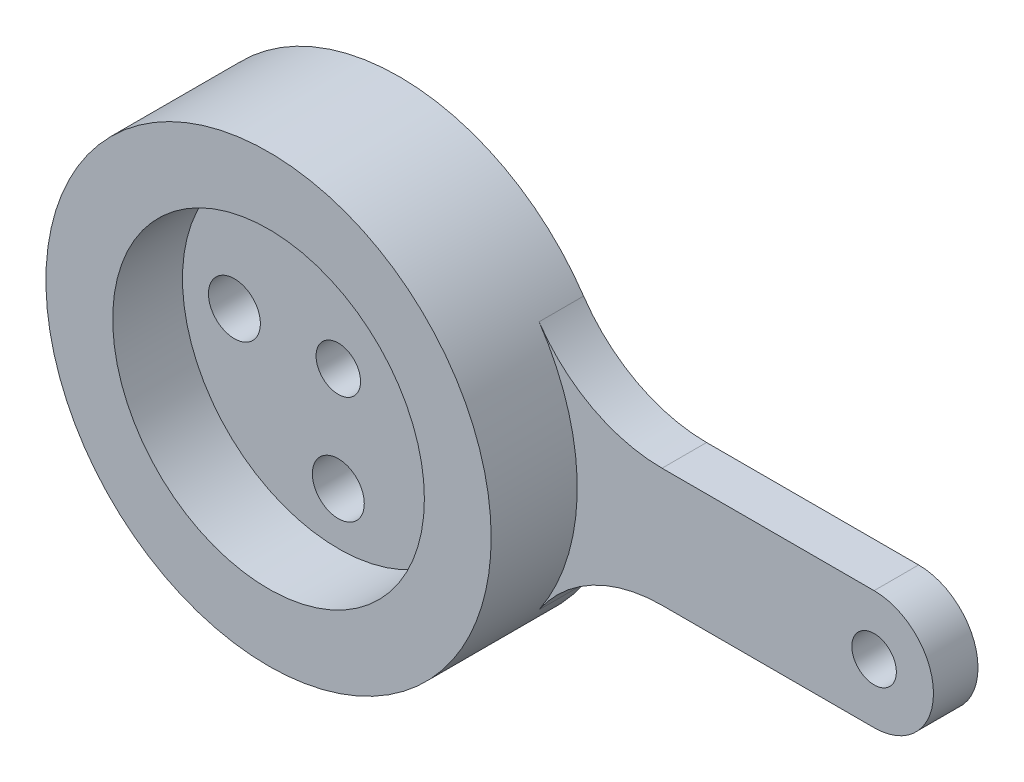
from build123d import *
from build123d.topology import SkipClean

# Parameters (mm, degrees)
SKETCH1_R           = 15
BOSS_EXTRUDE1_DEPTH = 8.8
CUT_EXTRUDE1_DEPTH  = 5
SKETCH3_R           = 1.5
CUT_EXTRUDE2_DEPTH  = 5
BOSS_EXTRUDE2_DEPTH = 3
FILLET1_R           = 10
FILLET2_R           = 10
SKETCH6_R           = 1.5
CUT_EXTRUDE4_DEPTH  = 3
SKETCH7_R           = 10.5
CUT_EXTRUDE6_DEPTH  = 5
BOSS_EXTRUDE3_DEPTH = 0.3
BOSS_EXTRUDE4_START = -4.7
BOSS_EXTRUDE4_DEPTH = 4.7
SKETCH11_R          = 1.5
CUT_EXTRUDE7_DEPTH  = 43.083250825
SKETCH12_R          = 1.75
CUT_EXTRUDE8_DEPTH  = 43.701756404


with BuildPart() as part:
    # Sketch1 → Boss-Extrude1 (new body)
    with BuildSketch(Plane.XY):
        Circle(SKETCH1_R)
    extrude(amount=BOSS_EXTRUDE1_DEPTH)

    # Sketch2 → Cut-Extrude1 (cut)
    with BuildSketch(Plane.XY.offset(8.8)):
        with BuildLine():
            Line((-2.469689731, 16.888114198), (-4.5, 3.968626967))
            ThreePointArc((-4.5, 3.968626967), (-6, 0), (-4.5, -3.968626967))
            Line((-4.5, -3.968626967), (-2.469689731, -16.888114198))
            ThreePointArc((-2.469689731, -16.888114198), (0, -19), (2.469689731, -16.888114198))
            Line((2.469689731, -16.888114198), (4.5, -3.968626967))
            ThreePointArc((4.5, -3.968626967), (6, 0), (4.5, 3.968626967))
            Line((4.5, 3.968626967), (2.469689731, 16.888114198))
            ThreePointArc((2.469689731, 16.888114198), (0, 19), (-2.469689731, 16.888114198))
        make_face()
    extrude(amount=-CUT_EXTRUDE1_DEPTH, mode=Mode.SUBTRACT)

    # Sketch3 → Cut-Extrude2 (cut)
    with BuildSketch(Plane.XY.offset(3.8)):
        Circle(SKETCH3_R)
    extrude(amount=-CUT_EXTRUDE2_DEPTH, mode=Mode.SUBTRACT)

    # Sketch4 → Boss-Extrude2 (add)
    with BuildSketch(Plane(origin=(0, 0, 0), x_dir=(-1, 0, 0), z_dir=(0, 0, -1))):
        with BuildLine():
            Line((-35, 4), (-14.456832295, 4))
            ThreePointArc((-14.456832295, 4), (-15, 0), (-14.456832295, -4))
            Line((-14.456832295, -4), (-35, -4))
            ThreePointArc((-35, -4), (-39, 0), (-35, 4))
        make_face()
    extrude(amount=-BOSS_EXTRUDE2_DEPTH)

    # Fillet1
    fillet1_edges = [part.edges().sort_by_distance(p)[0] for p in [
        (14.456832295, 4, 1.5),
    ]]
    fillet(fillet1_edges, radius=FILLET1_R)

    # Fillet2
    fillet2_edges = [part.edges().sort_by_distance(p)[0] for p in [
        (14.456832295, -4, 1.5),
    ]]
    fillet(fillet2_edges, radius=FILLET2_R)

    # Sketch6 → Cut-Extrude4 (cut)
    with BuildSketch(Plane.XY.offset(3)):
        with Locations((35, 0)):
            Circle(SKETCH6_R)
    extrude(amount=-CUT_EXTRUDE4_DEPTH, mode=Mode.SUBTRACT)

    # Sketch7 → Cut-Extrude6 (cut)
    with BuildSketch(Plane.XY.offset(3.8)):
        Circle(SKETCH7_R)
    extrude(amount=CUT_EXTRUDE6_DEPTH, mode=Mode.SUBTRACT)

    # Sketch8 → Boss-Extrude3 (add)
    with BuildSketch(Plane.XY.offset(3.8)):
        with BuildLine():
            Line((-2.808083405, 14.73481142), (-3.572005324, 9.873741842))
            ThreePointArc((-3.572005324, 9.873741842), (-10.5, 0), (-3.572005324, -9.873741842))
            Line((-3.572005324, -9.873741842), (-2.808083405, -14.73481142))
            ThreePointArc((-2.808083405, -14.73481142), (0, -15), (2.808083405, -14.73481142))
            Line((2.808083405, -14.73481142), (3.572005324, -9.873741842))
            ThreePointArc((3.572005324, -9.873741842), (10.5, 0), (3.572005324, 9.873741842))
            Line((3.572005324, 9.873741842), (2.808083405, 14.73481142))
            ThreePointArc((2.808083405, 14.73481142), (0, 15), (-2.808083405, 14.73481142))
        make_face()
    extrude(amount=BOSS_EXTRUDE3_DEPTH)

    # Sketch9 → Boss-Extrude4 (add)
    with SkipClean():  # the faces are left unmerged after this step: merging them gives an invalid solid
        with BuildSketch(Plane.XY.offset(8.8).offset(BOSS_EXTRUDE4_START)):
            with BuildLine():
                Line((-2.808083405, 14.73481142), (-3.572005324, 9.873741842))
                ThreePointArc((-3.572005324, 9.873741842), (0, 10.5), (3.572005324, 9.873741842))
                Line((3.572005324, 9.873741842), (2.808083405, 14.73481142))
                ThreePointArc((2.808083405, 14.73481142), (0, 15), (-2.808083405, 14.73481142))
            make_face()
            with BuildLine():
                Line((-3.572005324, -9.873741842), (-2.808083405, -14.73481142))
                ThreePointArc((-2.808083405, -14.73481142), (0, -15), (2.808083405, -14.73481142))
                Line((2.808083405, -14.73481142), (3.572005324, -9.873741842))
                ThreePointArc((3.572005324, -9.873741842), (0, -10.5), (-3.572005324, -9.873741842))
            make_face()
        extrude(amount=BOSS_EXTRUDE4_DEPTH)

    # Sketch11 → Cut-Extrude7 (cut, through all)
    with SkipClean():  # the faces are left unmerged after this step: merging them gives an invalid solid
        with BuildSketch(Plane(origin=(0, 0, 3.8), x_dir=(-1, 0, 0), z_dir=(0, 0, -1))):
            with Locations(Location((0, 0, 0), (0, 0, 180))):
                Circle(SKETCH11_R)
        extrude(amount=-CUT_EXTRUDE7_DEPTH, mode=Mode.SUBTRACT)

    # Sketch12 → Cut-Extrude8 (cut, through all)
    with SkipClean():  # the faces are left unmerged after this step: merging them gives an invalid solid
        with BuildSketch(Plane(origin=(0, 0, 0), x_dir=(-1, 0, 0), z_dir=(0, 0, -1))):
            with Locations((0, -7)):
                Circle(SKETCH12_R)
            with Locations((-7, 0)):
                Circle(SKETCH12_R)
            with Locations(Location((7, 0, 0), (0, 0, 180))):
                Circle(SKETCH12_R)
            with Locations(Location((0, 7, 0), (0, 0, 180))):
                Circle(SKETCH12_R)
        extrude(amount=-CUT_EXTRUDE8_DEPTH, mode=Mode.SUBTRACT)


solid = part.part
